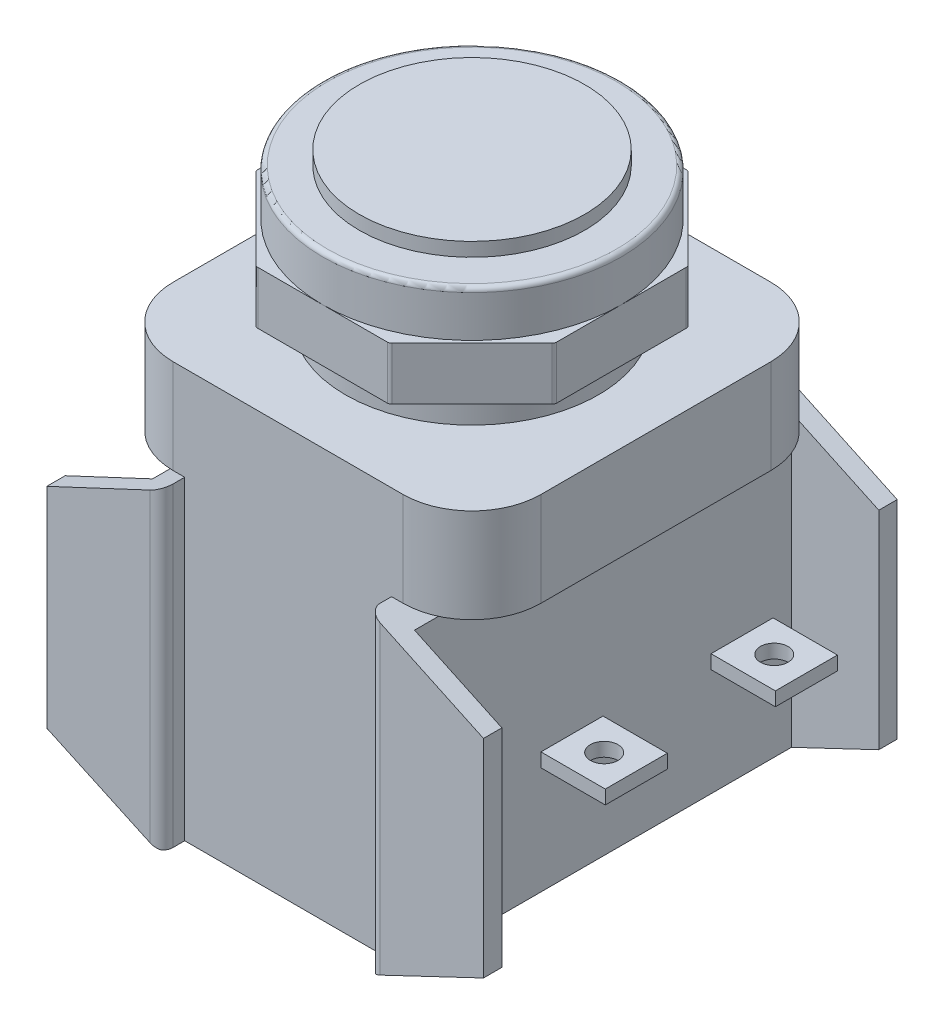
from build123d import *

# Parameters (mm, degrees)
SKETCH1_R           = 12.446
BOSS_EXTRUDE1_DEPTH = 1.524
SKETCH2_R           = 16.51
BOSS_EXTRUDE2_DEPTH = 5.08
BOSS_EXTRUDE3_DEPTH = 5.842
FILLET1_R           = 0.508
FILLET2_R           = 0.508
SKETCH4_R           = 13.97
BOSS_EXTRUDE4_DEPTH = 4.064
BOSS_EXTRUDE5_DEPTH = 10.414
SKETCH6_W           = 22.86
SKETCH6_H           = 40.64
BOSS_EXTRUDE6_DEPTH = 34.798
SKETCH7_R           = 2.286
CUT_EXTRUDE1_DEPTH  = 9.398
SKETCH9_W           = 45.72
SKETCH9_H           = 34.798
BOSS_EXTRUDE7_DEPTH = 12.7
SKETCH10_W          = 41.656
SKETCH10_H          = 34.798
CUT_EXTRUDE2_DEPTH  = 9.652
CUT_EXTRUDE4_DEPTH  = 81.511990312
CUT_EXTRUDE5_DEPTH  = 81.511990312
SKETCH13_W          = 6.858
SKETCH13_H          = 1.524
BOSS_EXTRUDE8_DEPTH = 7.112
SKETCH14_W          = 6.604
SKETCH14_H          = 1.524
BOSS_EXTRUDE9_DEPTH = 7.112
SKETCH16_R          = 1.524
CUT_EXTRUDE7_DEPTH  = 7.112
SKETCH17_R          = 1.524
CUT_EXTRUDE8_DEPTH  = 12.7
FILLET3_R           = 1.27


with BuildPart() as part:
    # Sketch1 → Boss-Extrude1 (new body)
    with BuildSketch(Plane(origin=(0, 0, 0), x_dir=(1, 0, 0), z_dir=(0, 1, 0))):
        with Locations(Location((0, 0, 0), (0, 0, 270))):
            Circle(SKETCH1_R)
    extrude(amount=-BOSS_EXTRUDE1_DEPTH)

    # Sketch2 → Boss-Extrude2 (add)
    with BuildSketch(Plane.XZ.offset(1.524)):
        with Locations(Location((0, 0, 0), (0, 0, 270))):
            Circle(SKETCH2_R)
    extrude(amount=BOSS_EXTRUDE2_DEPTH)

    # Sketch3 → Boss-Extrude3 (add)
    with BuildSketch(Plane.XZ.offset(6.604)):
        Polygon((16.51, 7.366), (16.51, -7.366), (7.366, -16.51), (-7.366, -16.51), (-16.51, -7.366), (-16.51, 7.366), (-7.366, 16.51), (7.366, 16.51), align=None)
    extrude(amount=BOSS_EXTRUDE3_DEPTH)

    # Fillet1
    fillet1_edges = [part.edges().sort_by_distance(p)[0] for p in [
        (0, -1.524, 16.51),
    ]]
    fillet(fillet1_edges, radius=FILLET1_R)

    # Fillet2
    fillet2_edges = [part.edges().sort_by_distance(p)[0] for p in [
        (7.366, -9.525, -16.51),
        (16.51, -9.525, -7.366),
        (16.51, -9.525, 7.366),
        (7.366, -9.525, 16.51),
        (-7.366, -9.525, 16.51),
        (-16.51, -9.525, 7.366),
        (-16.51, -9.525, -7.366),
        (-7.366, -9.525, -16.51),
    ]]
    fillet(fillet2_edges, radius=FILLET2_R)

    # Sketch4 → Boss-Extrude4 (add)
    with BuildSketch(Plane.XZ.offset(12.446)):
        with Locations(Location((0, 0, 0), (0, 0, 270))):
            Circle(SKETCH4_R)
    extrude(amount=BOSS_EXTRUDE4_DEPTH)

    # Sketch5 → Boss-Extrude5 (add)
    with BuildSketch(Plane.XZ.offset(16.51)):
        with BuildLine():
            Line((12.7, 20.32), (-12.7, 20.32))
            ThreePointArc((-12.7, 20.32), (-18.088153673, 18.088153673), (-20.32, 12.7))
            Line((-20.32, 12.7), (-20.32, -12.7))
            ThreePointArc((-20.32, -12.7), (-18.088153673, -18.088153673), (-12.7, -20.32))
            Line((-12.7, -20.32), (12.7, -20.32))
            ThreePointArc((12.7, -20.32), (18.088153673, -18.088153673), (20.32, -12.7))
            Line((20.32, -12.7), (20.32, 12.7))
            ThreePointArc((20.32, 12.7), (18.088153673, 18.088153673), (12.7, 20.32))
        make_face()
    extrude(amount=BOSS_EXTRUDE5_DEPTH)

    # Sketch6 → Boss-Extrude6 (add)
    with BuildSketch(Plane.XZ.offset(26.924)):
        Rectangle(SKETCH6_W, SKETCH6_H)
    extrude(amount=BOSS_EXTRUDE6_DEPTH)

    # Sketch7 → Cut-Extrude1 (cut)
    with BuildSketch(Plane.XZ.offset(61.722)):
        with Locations(Location((0, -12.7, 0), (0, 0, 270))):
            Circle(SKETCH7_R)
        with Locations(Location((0, 12.7, 0), (0, 0, 270))):
            Circle(SKETCH7_R)
    extrude(amount=-CUT_EXTRUDE1_DEPTH, mode=Mode.SUBTRACT)

    # Sketch9 → Boss-Extrude7 (add)
    with BuildSketch(Plane(origin=(11.43, 0, 0), x_dir=(0, 0, -1), z_dir=(1, 0, 0))):
        with Locations((0, -44.323)):
            Rectangle(SKETCH9_W, SKETCH9_H)
    boss_extrude7 = extrude(amount=BOSS_EXTRUDE7_DEPTH)

    # Mirror1: Boss-Extrude7 across plane
    add(boss_extrude7.mirror(Plane(origin=(0, 0, 0), x_dir=(0, 0, 1), z_dir=(1, 0, 0))))

    # Sketch10 → Cut-Extrude2 (cut)
    with BuildSketch(Plane(origin=(24.13, 0, 0), x_dir=(0, 0, -1), z_dir=(1, 0, 0))):
        with Locations((0, -44.323)):
            Rectangle(SKETCH10_W, SKETCH10_H)
    cut_extrude2 = extrude(amount=-CUT_EXTRUDE2_DEPTH, mode=Mode.SUBTRACT)

    # Mirror2: Cut-Extrude2 across plane
    add(cut_extrude2.mirror(Plane(origin=(0, 0, 0), x_dir=(0, 0, 1), z_dir=(1, 0, 0))), mode=Mode.SUBTRACT)

    # Sketch11 → Cut-Extrude4 (cut, through all)
    with BuildSketch(Plane(origin=(0, 0, -22.86), x_dir=(-1, 0, 0), z_dir=(0, 0, -1))):
        Polygon((-11.43, -26.924), (-24.13, -32.874707767), (-24.13, -26.924), align=None)
        Polygon((24.13, -32.874707767), (24.13, -26.924), (11.43, -26.924), align=None)
        Polygon((11.326658159, -61.931639732), (24.061569251, -56.056015305), (24.026436821, -62.006619362), align=None)
        Polygon((-24.197589663, -55.77109271), (-24.232722094, -61.721696766), (-11.532943432, -61.796676397), align=None)
    extrude(amount=-CUT_EXTRUDE4_DEPTH, mode=Mode.SUBTRACT)

    # Sketch12 → Cut-Extrude5 (cut, through all)
    with BuildSketch(Plane(origin=(0, 0, -22.86), x_dir=(-1, 0, 0), z_dir=(0, 0, -1))):
        Polygon((27.344093716, -61.722), (27.344093716, -56.075395365), (24.061569251, -56.056015305), (20.546985538, -61.722), align=None)
    extrude(amount=-CUT_EXTRUDE5_DEPTH, mode=Mode.SUBTRACT)

    # Sketch13 → Boss-Extrude8 (add)
    with BuildSketch(Plane(origin=(14.478, 0, 0), x_dir=(0, 0, -1), z_dir=(1, 0, 0))):
        with Locations((-3.429, -47.752)):
            Rectangle(SKETCH13_W, SKETCH13_H)
        with Locations((15.367, -47.752)):
            Rectangle(SKETCH13_W, SKETCH13_H)
    extrude(amount=BOSS_EXTRUDE8_DEPTH)

    # Sketch14 → Boss-Extrude9 (add)
    with BuildSketch(Plane.ZY.offset(14.478)):
        with Locations((-3.302, -45.176922844)):
            Rectangle(SKETCH14_W, SKETCH14_H)
        with Locations((16.764, -45.176922844)):
            Rectangle(SKETCH14_W, SKETCH14_H)
    extrude(amount=BOSS_EXTRUDE9_DEPTH)

    # Sketch16 → Cut-Extrude7 (cut)
    with BuildSketch(Plane.XZ.offset(45.938922844)):
        with Locations(Location((-18.034, -3.302, 0), (0, 0, 270))):
            Circle(SKETCH16_R)
        with Locations(Location((-18.034, 16.764, 0), (0, 0, 270))):
            Circle(SKETCH16_R)
        with Locations((18.034, 3.429)):
            Circle(SKETCH16_R)
        with Locations((18.034, -15.367)):
            Circle(SKETCH16_R)
    extrude(amount=-CUT_EXTRUDE7_DEPTH, mode=Mode.SUBTRACT)

    # Sketch17 → Cut-Extrude8 (cut)
    with BuildSketch(Plane(origin=(0, -38.1, 0), x_dir=(1, 0, 0), z_dir=(0, 1, 0))):
        with Locations(Location((18.034, 15.367, 0), (0, 0, 270))):
            Circle(SKETCH17_R)
        with Locations(Location((18.034, -3.429, 0), (0, 0, 270))):
            Circle(SKETCH17_R)
    extrude(amount=-CUT_EXTRUDE8_DEPTH, mode=Mode.SUBTRACT)

    # Fillet3
    fillet3_edges = [part.edges().sort_by_distance(p)[0] for p in [
        (-11.43, -44.323, -22.86),
        (11.43, -44.323, -22.86),
        (-11.43, -44.323, 22.86),
        (11.43, -44.323, 22.86),
    ]]
    fillet(fillet3_edges, radius=FILLET3_R)


solid = part.part
